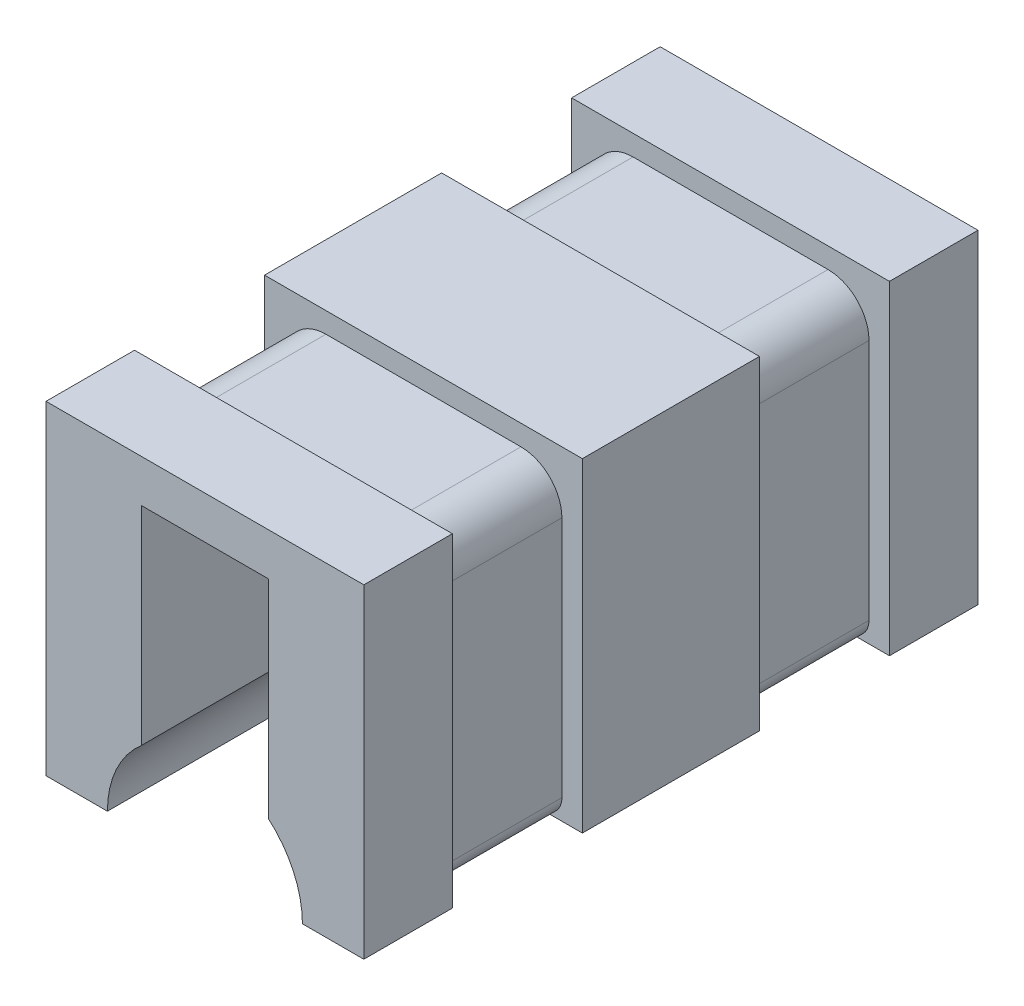
from build123d import *

# Parameters (mm, degrees)
BOSS_EXTRUDE1_DEPTH  = 15
CUT_EXTRUDE1_DEPTH   = 3.175
MIRROR4_COPY_1_DEPTH = 3.175
FILLET1_R            = 2
FILLET2_R            = 1


with BuildPart() as part:
    # Sketch1 → Boss-Extrude1 (new, symmetric)
    with BuildSketch(Plane.XY):
        with BuildLine():
            Line((-3.1, 3.61543998), (-3.1, 13.7625))
            Line((-3.1, 13.7625), (3.1, 13.7625))
            Line((3.1, 13.7625), (3.1, 3.61543998))
            ThreePointArc((3.1, 3.61543998), (4.326959455, 1.989680408), (4.7625, 0))
            Line((4.7625, 0), (7.7625, 0))
            Line((7.7625, 0), (7.7625, 15.84052737))
            Line((7.7625, 15.84052737), (-7.7625, 15.84052737))
            Line((-7.7625, 15.84052737), (-7.7625, 0))
            Line((-7.7625, 0), (-4.7625, 0))
            ThreePointArc((-4.7625, 0), (-4.326959455, 1.989680408), (-3.1, 3.61543998))
        make_face()
    extrude(amount=BOSS_EXTRUDE1_DEPTH, both=True)

    # Sketch2 → Cut-Extrude1 (cut, symmetric)
    with BuildSketch(Plane.XY.offset(7.5)):
        Polygon((-7.7625, 15.84052737), (-7.7625, 0), (-6.7625, 0), (-6.7625, 14.84052737), (0, 14.84052737), (0, 15.84052737), align=None)
    cut_extrude1 = extrude(amount=CUT_EXTRUDE1_DEPTH, both=True, mode=Mode.SUBTRACT)

    # Mirror3: Cut-Extrude1 across plane
    add(cut_extrude1.mirror(Plane(origin=(0, 0, 0), x_dir=(0, 0, 1), z_dir=(1, 0, 0))), mode=Mode.SUBTRACT)

    # Mirror4: Cut-Extrude1 across plane
    add(cut_extrude1.mirror(Plane.XY), mode=Mode.SUBTRACT)

    # Mirror4 copy 1 sketch → Mirror4 copy 1 (cut, symmetric)
    with BuildSketch(Plane(origin=(0, 0, -7.5), x_dir=(-1, 0, 0), z_dir=(0, 0, -1))):
        Polygon((-7.7625, 15.84052737), (-7.7625, 0), (-6.7625, 0), (-6.7625, 14.84052737), (0, 14.84052737), (0, 15.84052737), align=None)
    extrude(amount=MIRROR4_COPY_1_DEPTH, both=True, mode=Mode.SUBTRACT)

    # Fillet1
    fillet1_edges = [part.edges().sort_by_distance(p)[0] for p in [
        (-6.7625, 14.84052737, 7.5),
        (6.7625, 14.84052737, 7.5),
        (-6.7625, 14.84052737, -7.5),
        (6.7625, 14.84052737, -7.5),
    ]]
    fillet(fillet1_edges, radius=FILLET1_R)

    # Fillet2
    fillet2_edges = [part.edges().sort_by_distance(p)[0] for p in [
        (-6.7625, 0, 7.5),
        (6.7625, 0, 7.5),
        (-6.7625, 0, -7.5),
        (6.7625, 0, -7.5),
    ]]
    fillet(fillet2_edges, radius=FILLET2_R)


solid = part.part
